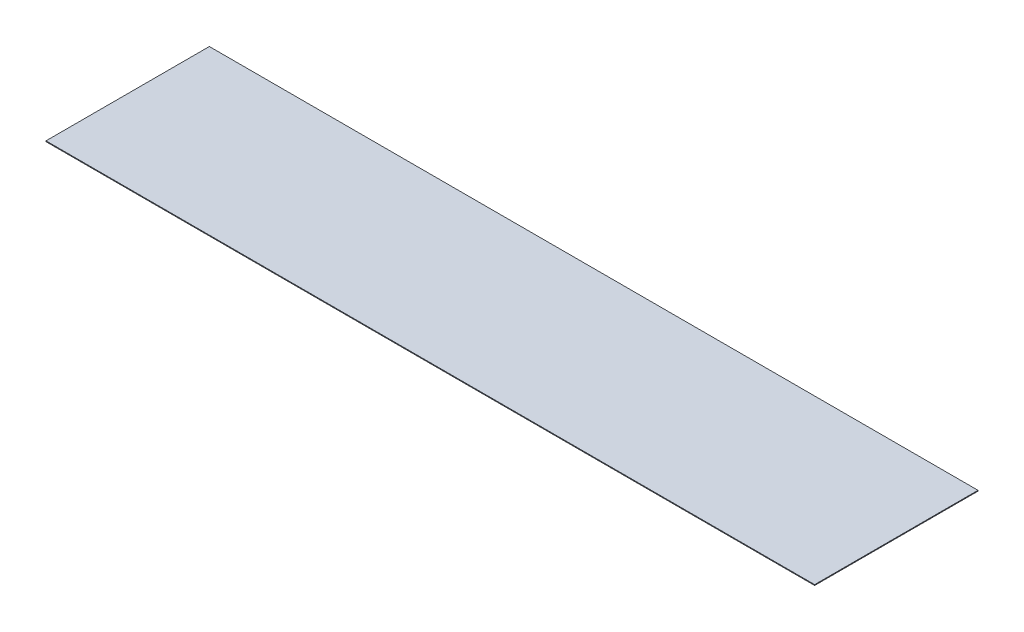
from build123d import *

# Parameters (mm, degrees)
SKETCH_1_W      = 1000
SKETCH_1_H      = 212.5
EXTRUDE_1_DEPTH = 1


with BuildPart() as part:
    # Эскиз1 → Бобышка-Вытянуть1 (new body)
    with BuildSketch(Plane(origin=(0, 0, 0), x_dir=(1, 0, 0), z_dir=(0, 1, 0))):
        Rectangle(SKETCH_1_W, SKETCH_1_H)
    extrude(amount=EXTRUDE_1_DEPTH)


solid = part.part
